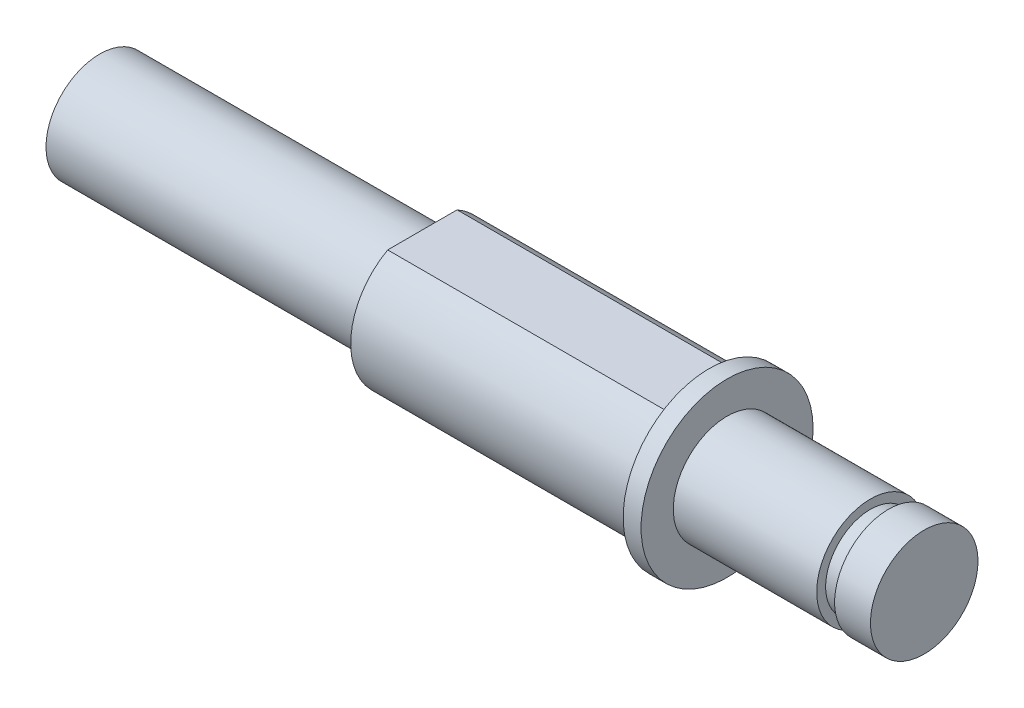
from build123d import *

# Parameters (mm, degrees)
SKETCH_1_R          = 1.5
EXTRUDE_1_DEPTH     = 23
SKETCH_2_R          = 1.5
EXTRUDE_2_DEPTH     = 8
SKETCH_3_R          = 2.4
SKETCH_3_R_2        = 1.5
EXTRUDE_3_DEPTH     = 0.5
CUT_EXTRUDE_START   = -1.5
SKETCH_4_R          = 1.5
SKETCH_4_R_2        = 1.25
CUT_EXTRUDE_1_DEPTH = 0.5


with BuildPart() as part:
    # 草图1 → 凸台-拉伸1 (new body)
    with BuildSketch(Plane(origin=(0, 0, 0), x_dir=(0, 0, -1), z_dir=(1, 0, 0))):
        Circle(SKETCH_1_R)
    extrude(amount=EXTRUDE_1_DEPTH)

    # 草图2 → 凸台-拉伸2 (add)
    with BuildSketch(Plane.ZY.offset(-9)):
        with BuildLine():
            Line((0.968245837, 1.75), (-0.968245837, 1.75))
            ThreePointArc((-0.968245837, 1.75), (0, -2), (0.968245837, 1.75))
        make_face()
        Circle(SKETCH_2_R, mode=Mode.SUBTRACT)
    extrude(amount=-EXTRUDE_2_DEPTH)

    # 草图3 → 凸台-拉伸3 (add)
    with BuildSketch(Plane(origin=(17, 0, 0), x_dir=(0, 0, -1), z_dir=(1, 0, 0))):
        Circle(SKETCH_3_R)
        with Locations(Location((0, 0, 0), (0, 0, 180))):
            Circle(SKETCH_3_R_2, mode=Mode.SUBTRACT)
    extrude(amount=EXTRUDE_3_DEPTH)

    # 草图4 → 切除-拉伸1 (cut)
    with BuildSketch(Plane(origin=(23, 0, 0), x_dir=(0, 0, -1), z_dir=(1, 0, 0)).offset(CUT_EXTRUDE_START)):
        Circle(SKETCH_4_R)
        Circle(SKETCH_4_R_2, mode=Mode.SUBTRACT)
    extrude(amount=CUT_EXTRUDE_1_DEPTH, mode=Mode.SUBTRACT)


solid = part.part
